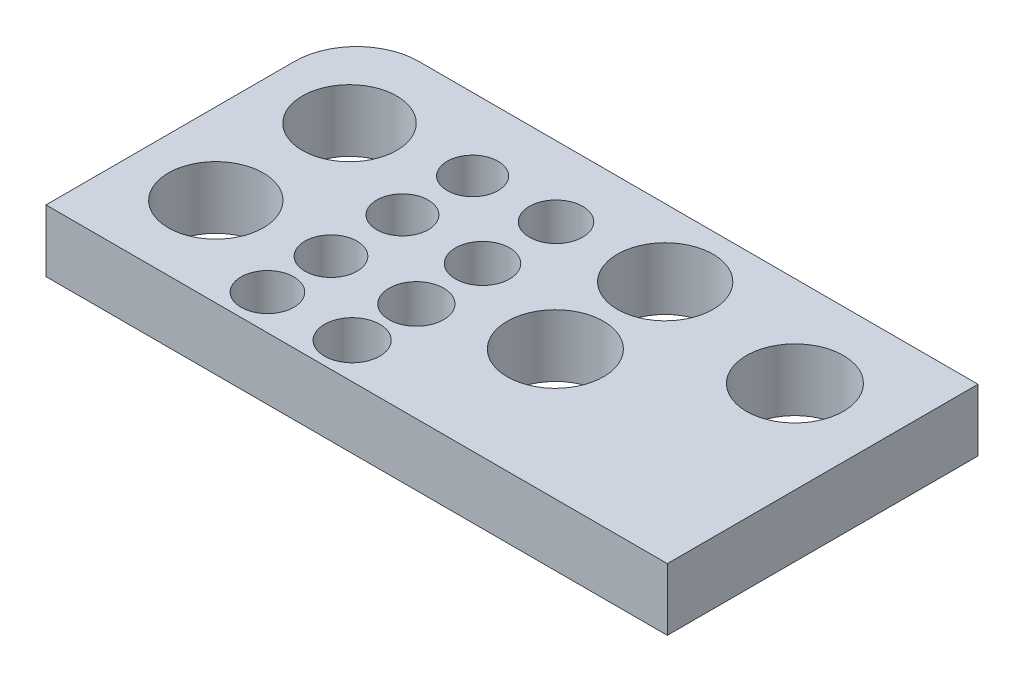
from build123d import *

# Parameters (mm, degrees)
SKETCH1_W              = 100
SKETCH1_H              = 50
BOSS_EXTRUDE1_DEPTH    = 10
FILLET1_R              = 10
F_1_0MM_DOWEL_HOLE1_D  = 15.2
F_1_0MM_DOWEL_HOLE2_D  = 15.3
F_1_0MM_DOWEL_HOLE3_D  = 8.2
F_1_0MM_DOWEL_HOLE4_D  = 8.3
F_1_0MM_DOWEL_HOLE5_D  = 8.4
F_1_0MM_DOWEL_HOLE6_D  = 8.5
F_1_0MM_DOWEL_HOLE7_D  = 8.6
F_1_0MM_DOWEL_HOLE8_D  = 8.7
F_1_0MM_DOWEL_HOLE9_D  = 8.8
F_1_0MM_DOWEL_HOLE10_D = 8.9
F_1_0MM_DOWEL_HOLE11_D = 15.4
F_1_0MM_DOWEL_HOLE12_D = 15.5
F_1_0MM_DOWEL_HOLE13_D = 15.6


with BuildPart() as part:
    # Sketch1 → Boss-Extrude1 (new body)
    with BuildSketch(Plane(origin=(0, 0, 0), x_dir=(1, 0, 0), z_dir=(0, 1, 0))):
        Rectangle(SKETCH1_W, SKETCH1_H)
    extrude(amount=BOSS_EXTRUDE1_DEPTH)

    # Fillet1
    fillet1_edges = [part.edges().sort_by_distance(p)[0] for p in [
        (-50, 5, -25),
    ]]
    fillet(fillet1_edges, radius=FILLET1_R)

    # Ø1.0mm Dowel Hole1 (through all)
    with Locations(Plane(origin=(0, 10, 0), x_dir=(1, 0, 0), z_dir=(0, 1, 0))):
        with Locations((-36.962140768, 10.811692473)):
            Hole(F_1_0MM_DOWEL_HOLE1_D / 2)

    # Ø1.0mm Dowel Hole2 (through all)
    with Locations(Plane(origin=(0, 10, 0), x_dir=(1, 0, 0), z_dir=(0, 1, 0))):
        with Locations((-36.962140768, -10.705173335)):
            Hole(F_1_0MM_DOWEL_HOLE2_D / 2)

    # Ø1.0mm Dowel Hole3 (through all)
    with Locations(Plane(origin=(0, 10, 0), x_dir=(1, 0, 0), z_dir=(0, 1, 0))):
        with Locations((-19.706040467, 13.368151776)):
            Hole(F_1_0MM_DOWEL_HOLE3_D / 2)

    # Ø1.0mm Dowel Hole4 (through all)
    with Locations(Plane(origin=(0, 10, 0), x_dir=(1, 0, 0), z_dir=(0, 1, 0))):
        with Locations((-19.919078743, 2.29016146)):
            Hole(F_1_0MM_DOWEL_HOLE4_D / 2)

    # Ø1.0mm Dowel Hole5 (through all)
    with Locations(Plane(origin=(0, 10, 0), x_dir=(1, 0, 0), z_dir=(0, 1, 0))):
        with Locations((-19.919078743, -9.213905408)):
            Hole(F_1_0MM_DOWEL_HOLE5_D / 2)

    # Ø1.0mm Dowel Hole6 (through all)
    with Locations(Plane(origin=(0, 10, 0), x_dir=(1, 0, 0), z_dir=(0, 1, 0))):
        with Locations((-20.02559788, -19.333223485)):
            Hole(F_1_0MM_DOWEL_HOLE6_D / 2)

    # Ø1.0mm Dowel Hole7 (through all)
    with Locations(Plane(origin=(0, 10, 0), x_dir=(1, 0, 0), z_dir=(0, 1, 0))):
        with Locations((-6.604186535, 13.687709189)):
            Hole(F_1_0MM_DOWEL_HOLE7_D / 2)

    # Ø1.0mm Dowel Hole8 (through all)
    with Locations(Plane(origin=(0, 10, 0), x_dir=(1, 0, 0), z_dir=(0, 1, 0))):
        with Locations((-6.710705673, 1.970604047)):
            Hole(F_1_0MM_DOWEL_HOLE8_D / 2)

    # Ø1.0mm Dowel Hole9 (through all)
    with Locations(Plane(origin=(0, 10, 0), x_dir=(1, 0, 0), z_dir=(0, 1, 0))):
        with Locations((-6.39114826, -9.000867132)):
            Hole(F_1_0MM_DOWEL_HOLE9_D / 2)

    # Ø1.0mm Dowel Hole10 (through all)
    with Locations(Plane(origin=(-6.497667397, 10, 19.226704348), x_dir=(0, 0, 1), z_dir=(0, 1, 0))):
        with Locations((0, 0)):
            Hole(F_1_0MM_DOWEL_HOLE10_D / 2)

    # Ø1.0mm Dowel Hole11 (through all)
    with Locations(Plane(origin=(0, 10, 0), x_dir=(1, 0, 0), z_dir=(0, 1, 0))):
        with Locations((10.545394628, 14.11378574)):
            Hole(F_1_0MM_DOWEL_HOLE11_D / 2)

    # Ø1.0mm Dowel Hole12 (through all)
    with Locations(Plane(origin=(0, 10, 0), x_dir=(1, 0, 0), z_dir=(0, 1, 0))):
        with Locations((11.077990317, -4.1009868)):
            Hole(F_1_0MM_DOWEL_HOLE12_D / 2)

    # Ø1.0mm Dowel Hole13 (through all)
    with Locations(Plane(origin=(0, 10, 0), x_dir=(1, 0, 0), z_dir=(0, 1, 0))):
        with Locations((35.151315428, 10.385615922)):
            Hole(F_1_0MM_DOWEL_HOLE13_D / 2)


solid = part.part
